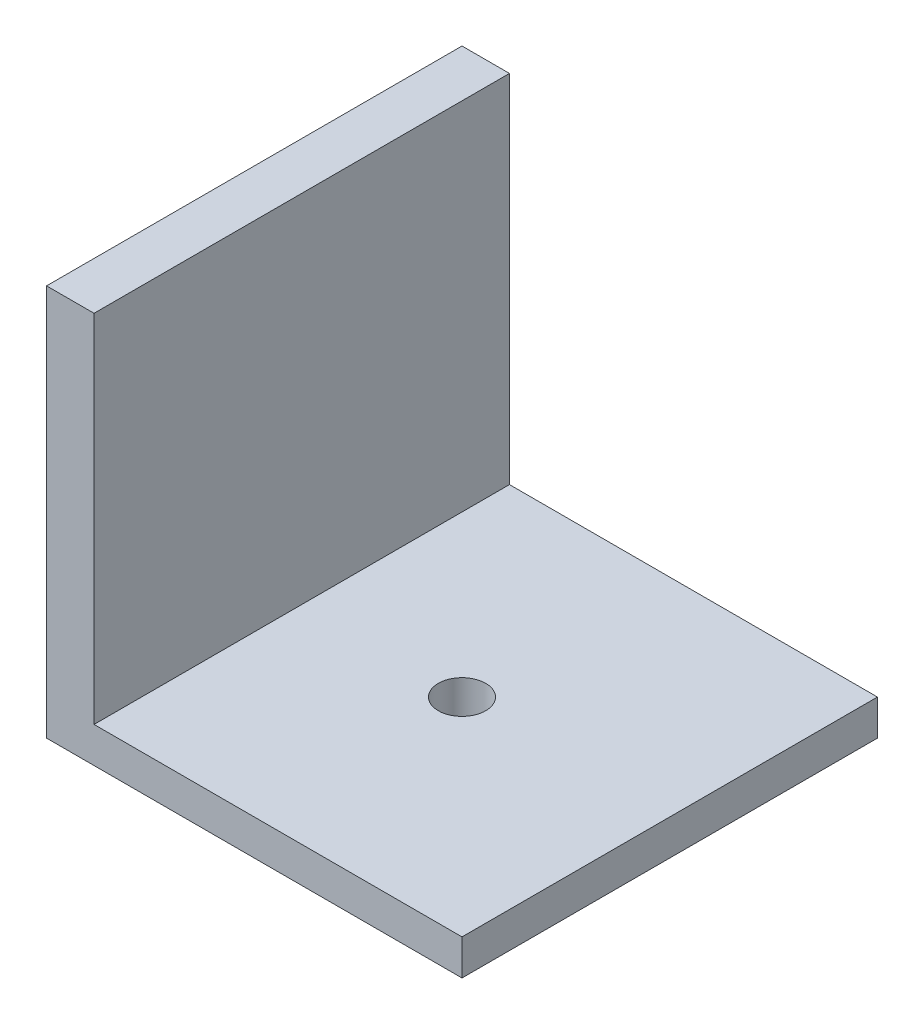
from build123d import *

# Parameters (mm, degrees)
SKETCH1_W           = 35
SKETCH1_H           = 35
SKETCH1_R           = 2
BOSS_EXTRUDE1_DEPTH = 3
SKETCH2_W           = 4
SKETCH2_H           = 35
BOSS_EXTRUDE2_DEPTH = 30
SKETCH3_R           = 4
BOSS_EXTRUDE3_DEPTH = 8


with BuildPart() as part:
    # Sketch1 → Boss-Extrude1 (new body)
    with BuildSketch(Plane(origin=(0, 0, 0), x_dir=(1, 0, 0), z_dir=(0, 1, 0))):
        Rectangle(SKETCH1_W, SKETCH1_H)
        with Locations(Location((0, 0, 0), (0, 0, 270))):
            Circle(SKETCH1_R, mode=Mode.SUBTRACT)
    extrude(amount=BOSS_EXTRUDE1_DEPTH)

    # Sketch2 → Boss-Extrude2 (add)
    with BuildSketch(Plane(origin=(0, 3, 0), x_dir=(1, 0, 0), z_dir=(0, 1, 0))):
        with Locations((-15.5, 0)):
            Rectangle(SKETCH2_W, SKETCH2_H)
    extrude(amount=BOSS_EXTRUDE2_DEPTH)

    # Sketch3 → Boss-Extrude3 (add)
    with BuildSketch(Plane.ZY.offset(17.5)):
        with Locations((0, 16.5)):
            Circle(SKETCH3_R)
    extrude(amount=BOSS_EXTRUDE3_DEPTH)


solid = part.part
